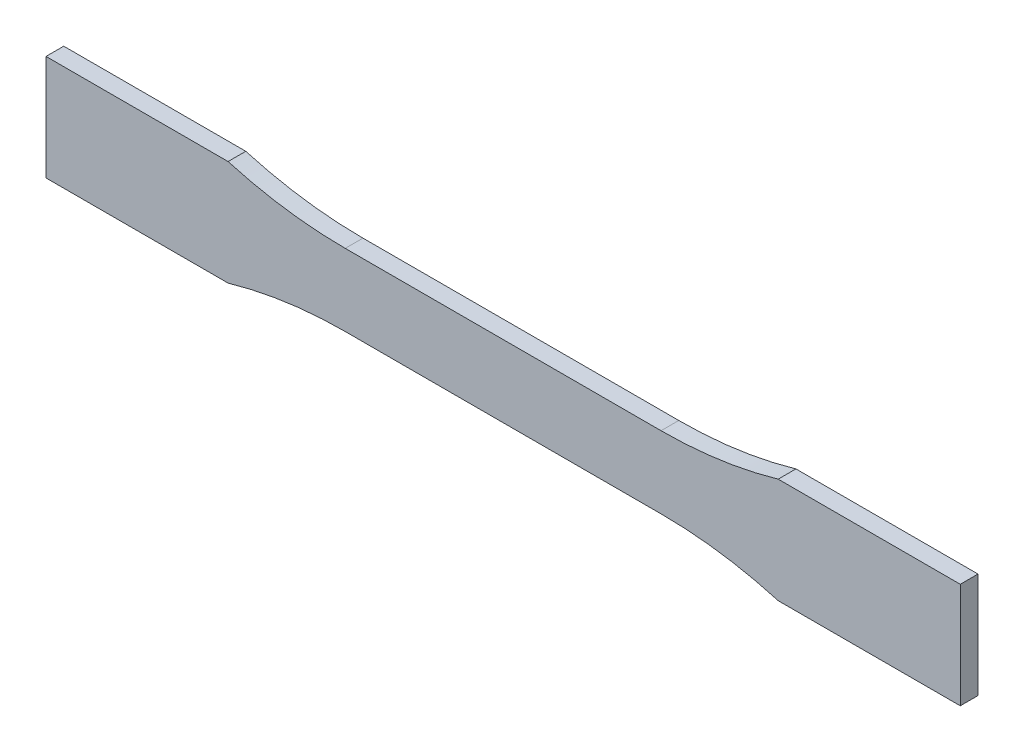
from build123d import *

# Parameters (mm, degrees)
BOSS_EXTRUDE1_DEPTH = 1.6


with BuildPart() as part:
    # Sketch1 → Boss-Extrude1 (new, symmetric)
    with BuildSketch(Plane.XY):
        with BuildLine():
            Line((-82.5, 9.5), (-82.5, -9.5))
            Line((-82.5, -9.5), (-49.642374512, -9.5))
            ThreePointArc((-49.642374512, -9.5), (-39.177078252, -7.253737634), (-28.5, -6.5))
            Line((-28.5, -6.5), (28.5, -6.5))
            ThreePointArc((28.5, -6.5), (39.177078252, -7.253737634), (49.642374512, -9.5))
            Line((49.642374512, -9.5), (82.5, -9.5))
            Line((82.5, -9.5), (82.5, 9.5))
            Line((82.5, 9.5), (49.642374512, 9.5))
            ThreePointArc((49.642374512, 9.5), (39.177078252, 7.253737634), (28.5, 6.5))
            Line((28.5, 6.5), (-28.5, 6.5))
            ThreePointArc((-28.5, 6.5), (-39.177078252, 7.253737634), (-49.642374512, 9.5))
            Line((-49.642374512, 9.5), (-82.5, 9.5))
        make_face()
    extrude(amount=BOSS_EXTRUDE1_DEPTH, both=True)


solid = part.part
